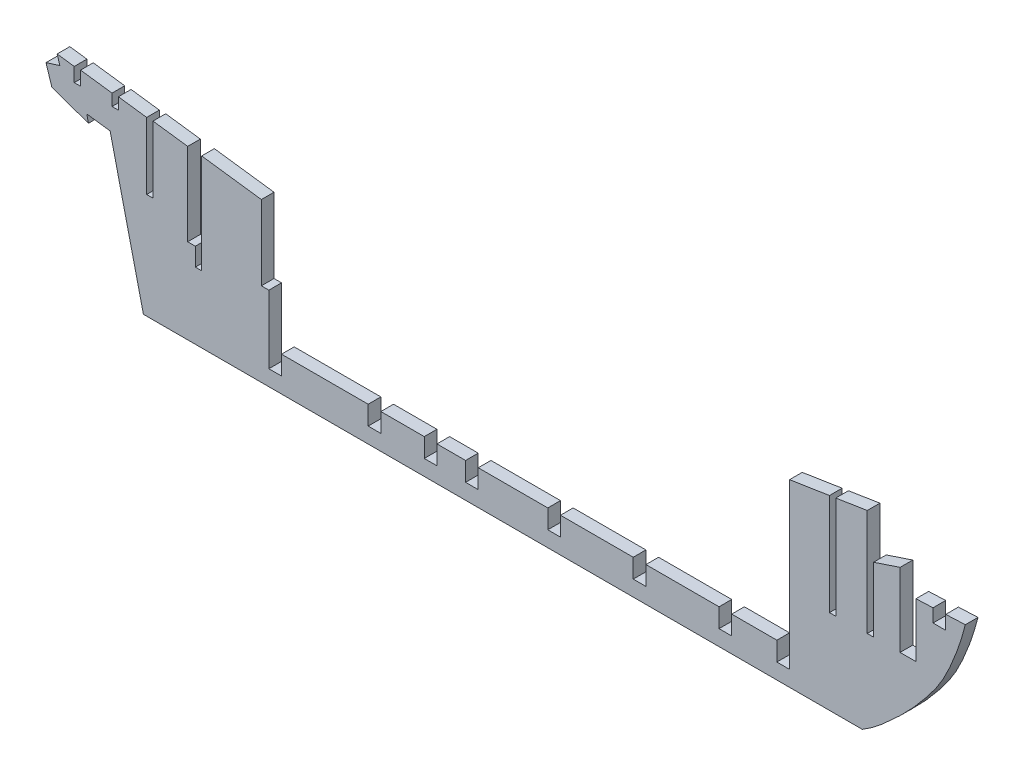
from build123d import *

# Parameters (mm, degrees)
EXTRUDE_1_DEPTH = 8


with BuildPart() as part:
    # 草图1 → 凸台-拉伸1 (new body)
    with BuildSketch(Plane.XY):
        with BuildLine():
            Line((-2.43e-07, -1.66e-07), (453.540462303, -1.66e-07))
            add(Edge.make_bspline(
                [(453.540462303, -1.66e-07), (460.79014459, 4.210016878), (469.569935404, 12.072340183), (483.622239053, 25.284804164), (493.197401943, 36.434132834), (502.695793901, 49.189345623), (511.206090033, 65.729365299), (516.029726356, 79.831331018), (518.53173017, 89.679905798)],
                knots=[0, 0, 0, 0, 0.219529356, 0.311377144, 0.509994522, 0.607272861, 0.731274185, 1, 1, 1, 1], degree=3))
            Line((518.53173017, 89.679905798), (506.162046562, 89.142399996))
            Line((506.162046562, 89.142399996), (506.162046562, 80.419495843))
            Line((506.162046562, 80.419495843), (498.162046562, 80.419495843))
            Line((498.162046562, 80.419495843), (498.162046562, 88.764379516))
            Line((498.162046562, 88.764379516), (487.370707866, 88.295458294))
            Line((487.370707866, 88.295458294), (487.370707866, 53.957597962))
            Line((487.370707866, 53.957597962), (477.370707866, 53.957597962))
            Line((477.370707866, 53.957597962), (477.370707866, 100.436233428))
            Line((477.370707866, 100.436233428), (460.65154086, 94.876216939))
            Line((460.65154086, 94.876216939), (460.65154086, 53.957597679))
            Line((460.65154086, 53.957597679), (456.65154086, 53.957597679))
            Line((456.65154086, 53.957597679), (456.65154086, 121.15189914))
            Line((456.65154086, 121.15189914), (436.824501135, 118.046777247))
            Line((436.824501135, 118.046777247), (436.824501135, 53.44350708))
            Line((436.824501135, 53.44350708), (432.824501135, 53.44350708))
            Line((432.824501135, 53.44350708), (432.824501135, 117.420335391))
            Line((432.824501135, 117.420335391), (407.629534965, 113.474540047))
            Line((407.629534965, 113.474540047), (407.629534965, 9.833214458))
            Line((407.629534965, 9.833214458), (399.629534965, 9.833214458))
            Line((399.629534965, 9.833214458), (399.629534965, 21.78896428))
            Line((399.629534965, 21.78896428), (371.149712291, 21.78896428))
            Line((371.149712291, 21.78896428), (371.149712291, 9.833214458))
            Line((371.149712291, 9.833214458), (363.149712291, 9.833214458))
            Line((363.149712291, 9.833214458), (363.149712291, 21.78896428))
            Line((363.149712291, 21.78896428), (317.013742993, 21.78896428))
            Line((317.013742993, 21.78896428), (317.013742993, 9.833214458))
            Line((317.013742993, 9.833214458), (309.013742993, 9.833214458))
            Line((309.013742993, 9.833214458), (309.013742993, 21.78896428))
            Line((309.013742993, 21.78896428), (263.112020096, 21.78896428))
            Line((263.112020096, 21.78896428), (263.112020096, 9.833214458))
            Line((263.112020096, 9.833214458), (255.112020096, 9.833214458))
            Line((255.112020096, 9.833214458), (255.112020096, 21.78896428))
            Line((255.112020096, 21.78896428), (211.237889646, 21.78896428))
            Line((211.237889646, 21.78896428), (211.237889646, 9.833214458))
            Line((211.237889646, 9.833214458), (203.237889646, 9.833214458))
            Line((203.237889646, 9.833214458), (203.237889646, 21.78896428))
            Line((203.237889646, 21.78896428), (185.170557109, 21.78896428))
            Line((185.170557109, 21.78896428), (185.170557109, 9.833214458))
            Line((185.170557109, 9.833214458), (177.170557109, 9.833214458))
            Line((177.170557109, 9.833214458), (177.170557109, 21.788961022))
            Line((177.170557109, 21.788961022), (149.785514419, 21.788961022))
            Line((149.785514419, 21.788961022), (149.785514419, 9.8332112))
            Line((149.785514419, 9.8332112), (141.785514419, 9.8332112))
            Line((141.785514419, 9.8332112), (141.785514419, 21.788961022))
            Line((141.785514419, 21.788961022), (87.128628071, 21.788961022))
            Line((87.128628071, 21.788961022), (87.128628071, 9.8332112))
            Line((87.128628071, 9.8332112), (79.128628071, 9.8332112))
            Line((79.128628071, 9.8332112), (79.128628071, 52.776041795))
            Line((79.128628071, 52.776041795), (74.39423211, 52.776041795))
            Line((74.39423211, 52.776041795), (74.39423211, 99.922139289))
            Line((74.39423211, 99.922139289), (36.732316161, 104.912244585))
            Line((36.732316161, 104.912244585), (36.732316161, 42.164639479))
            Line((36.732316161, 42.164639479), (32.732316161, 42.164639479))
            Line((32.732316161, 42.164639479), (32.732316161, 53.588490785))
            Line((32.732316161, 53.588490785), (27.905397524, 53.588490785))
            Line((27.905397524, 53.588490785), (27.905397524, 105.722742646))
            Line((27.905397524, 105.722742646), (6.037252299, 108.620214656))
            Line((6.037252299, 108.620214656), (6.037252299, 66.502939453))
            Line((6.037252299, 66.502939453), (2.037252299, 66.502939453))
            Line((2.037252299, 66.502939453), (2.037252299, 108.620214656))
            Line((2.037252299, 108.620214656), (-15.79290681, 110.982664073))
            Line((-15.79290681, 110.982664073), (-15.79290681, 103.648933932))
            Line((-15.79290681, 103.648933932), (-19.79290681, 103.648933932))
            Line((-19.79290681, 103.648933932), (-19.79290681, 110.982664073))
            Line((-19.79290681, 110.982664073), (-39.660668521, 113.615090503))
            Line((-39.660668521, 113.615090503), (-39.660668521, 104.769973164))
            Line((-39.660668521, 104.769973164), (-43.660668521, 104.769973164))
            Line((-43.660668521, 104.769973164), (-43.660668521, 113.615090503))
            Line((-43.660668521, 113.615090503), (-54.444933748, 115.043977421))
            Line((-54.444933748, 115.043977421), (-52.708792967, 109.575431))
            Line((-52.708792967, 109.575431), (-61.468269832, 106.794493648))
            Line((-61.468269832, 106.794493648), (-57.779206202, 95.174574379))
            Line((-57.779206202, 95.174574379), (-34.676393157, 87.040279865))
            Line((-34.676393157, 87.040279865), (-35.752643056, 91.631850135))
            Line((-35.752643056, 91.631850135), (-21.020693304, 89.679905349))
            Line((-21.020693304, 89.679905349), (-2.43e-07, -1.66e-07))
        make_face()
    extrude(amount=EXTRUDE_1_DEPTH)


solid = part.part
